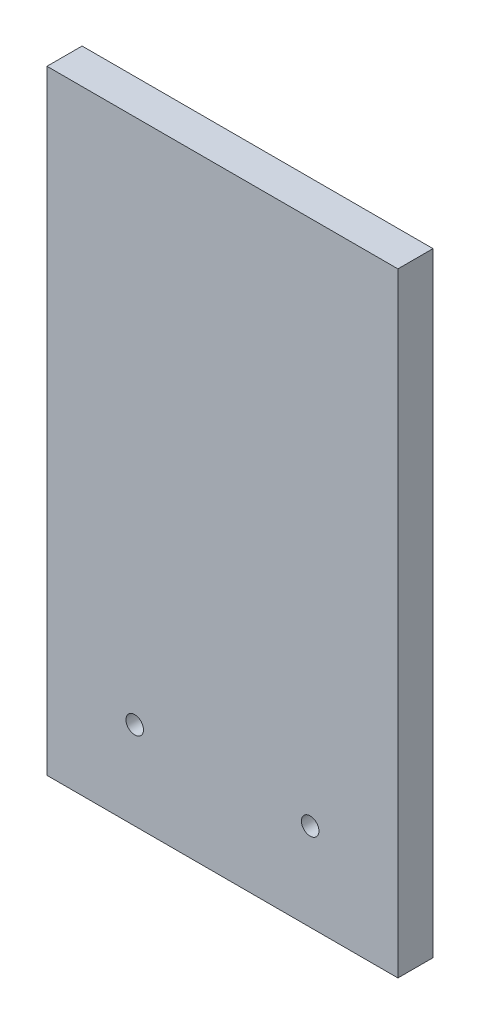
from build123d import *

# Parameters (mm, degrees)
ESBO_O1_W                = 100
ESBO_O1_H                = 175
RESSALTO_EXTRUS_O1_DEPTH = 10
ESBO_O2_R                = 2.5
CORTE_EXTRUS_O1_DEPTH    = 102.273145503


with BuildPart() as part:
    # Esboço1 → Ressalto-extrusão1 (new body)
    with BuildSketch(Plane.XY):
        Rectangle(ESBO_O1_W, ESBO_O1_H)
    extrude(amount=RESSALTO_EXTRUS_O1_DEPTH)

    # Esboço2 → Corte-extrusão1 (cut, through all)
    with BuildSketch(Plane.XY.offset(10)):
        with Locations((-25, -62.5)):
            Circle(ESBO_O2_R)
        with Locations((25, -62.5)):
            Circle(ESBO_O2_R)
    extrude(amount=-CORTE_EXTRUS_O1_DEPTH, mode=Mode.SUBTRACT)


solid = part.part
